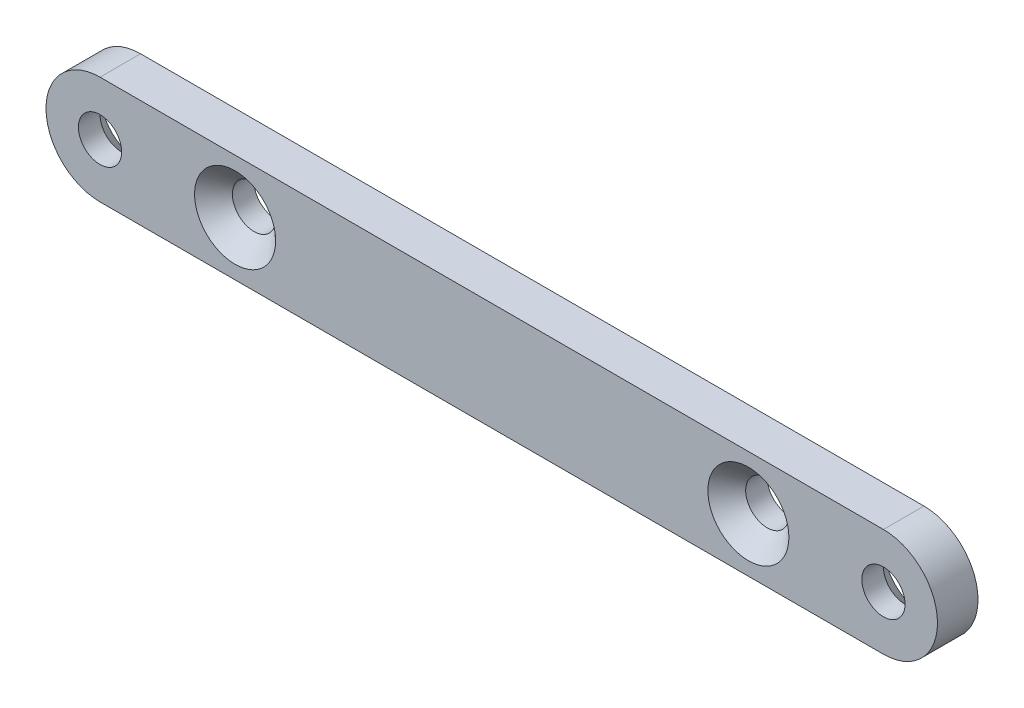
from build123d import *

# Parameters (mm, degrees)
SKETCH_1_R      = 1.6
EXTRUDE_1_DEPTH = 3
CHAMFER_1_SIZE  = 1.4


with BuildPart() as part:
    # 草图1 → 凸台-拉伸1 (new body)
    with BuildSketch(Plane.XY):
        with BuildLine():
            Line((-10, 4), (48, 4))
            ThreePointArc((48, 4), (52, 0), (48, -4))
            Line((48, -4), (-10, -4))
            ThreePointArc((-10, -4), (-14, 0), (-10, 4))
        make_face()
        Circle(SKETCH_1_R, mode=Mode.SUBTRACT)
        with Locations((38, 0)):
            Circle(SKETCH_1_R, mode=Mode.SUBTRACT)
        with Locations((-10, 0)):
            Circle(SKETCH_1_R, mode=Mode.SUBTRACT)
        with Locations((48, 0)):
            Circle(SKETCH_1_R, mode=Mode.SUBTRACT)
    extrude(amount=EXTRUDE_1_DEPTH)

    # 倒角1
    chamfer_1_edges = [part.edges().sort_by_distance(p)[0] for p in [
        (-1.6, 0, 3),
        (-11.6, 0, 0),
        (46.4, 0, 0),
        (36.4, 0, 3),
    ]]
    chamfer(chamfer_1_edges, length=CHAMFER_1_SIZE)


solid = part.part
